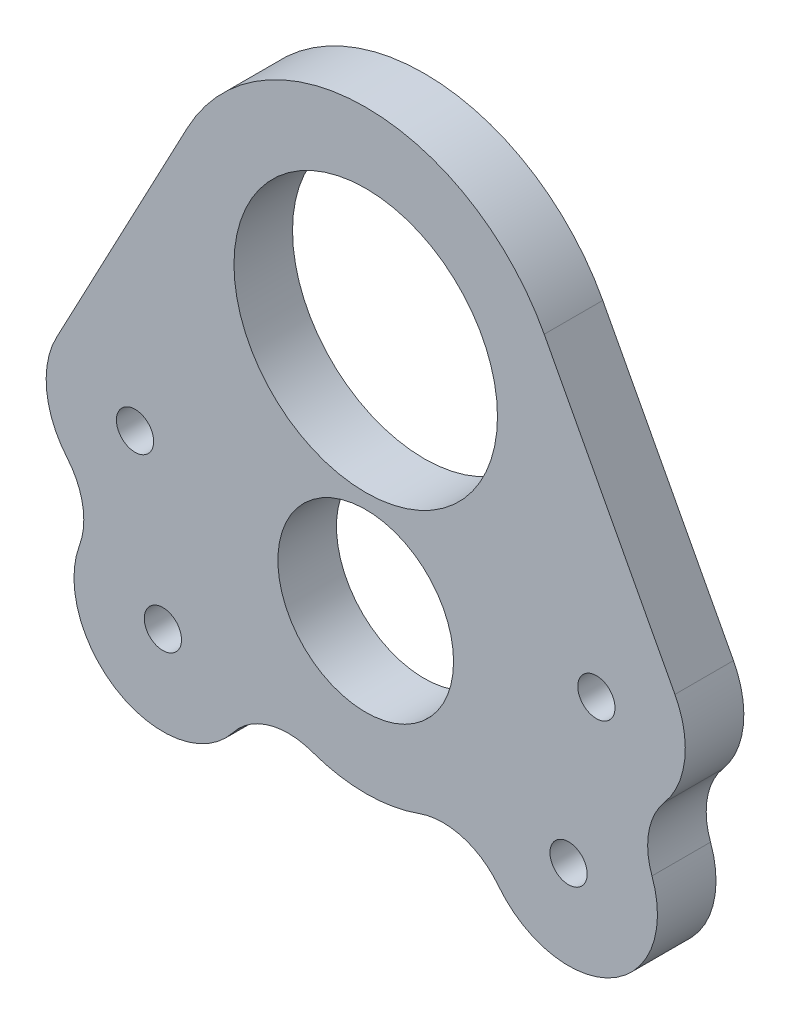
from build123d import *

# Parameters (mm, degrees)
SKETCH1_R           = 2.0193
SKETCH1_R_2         = 14.2875
SKETCH1_R_3         = 9.525
BOSS_EXTRUDE1_DEPTH = 6.35


with BuildPart() as part:
    # Sketch1 → Boss-Extrude1 (new body)
    with BuildSketch(Plane.XY):
        with BuildLine():
            Line((-33.53048127, 8.925931463), (-19.355373509, 35.661972159))
            ThreePointArc((-19.355373509, 35.661972159), (0, 47.3075), (19.355373509, 35.661972159))
            Line((19.355373509, 35.661972159), (33.53048127, 8.925931463))
            ThreePointArc((33.53048127, 8.925931463), (34.598037392, 3.378882244), (32.374264723, -1.813830556))
            ThreePointArc((32.374264723, -1.813830556), (30.688328298, -5.411180272), (31.04222425, -9.368207471))
            ThreePointArc((31.04222425, -9.368207471), (26.679838242, -21.125411227), (14.391737161, -18.62244825))
            ThreePointArc((14.391737161, -18.62244825), (10.500045405, -15.985191191), (5.801286392, -16.133694592))
            ThreePointArc((5.801286392, -16.133694592), (0, -17.145), (-5.801286392, -16.133694592))
            ThreePointArc((-5.801286392, -16.133694592), (-10.500045405, -15.985191191), (-14.391737161, -18.62244825))
            ThreePointArc((-14.391737161, -18.62244825), (-26.679838242, -21.125411227), (-31.04222425, -9.368207471))
            ThreePointArc((-31.04222425, -9.368207471), (-30.688328298, -5.411180272), (-32.374264723, -1.813830556))
            ThreePointArc((-32.374264723, -1.813830556), (-34.598037392, 3.378882244), (-33.53048127, 8.925931463))
        make_face()
        with Locations((25.014116927, 4.410663713)):
            Circle(SKETCH1_R, mode=Mode.SUBTRACT)
        with Locations((21.997045256, -12.7)):
            Circle(SKETCH1_R, mode=Mode.SUBTRACT)
        with Locations((-21.997045256, -12.7)):
            Circle(SKETCH1_R, mode=Mode.SUBTRACT)
        with Locations((-25.014116927, 4.410663713)):
            Circle(SKETCH1_R, mode=Mode.SUBTRACT)
        with Locations((0, 25.4)):
            Circle(SKETCH1_R_2, mode=Mode.SUBTRACT)
        Circle(SKETCH1_R_3, mode=Mode.SUBTRACT)
    extrude(amount=BOSS_EXTRUDE1_DEPTH)


solid = part.part
